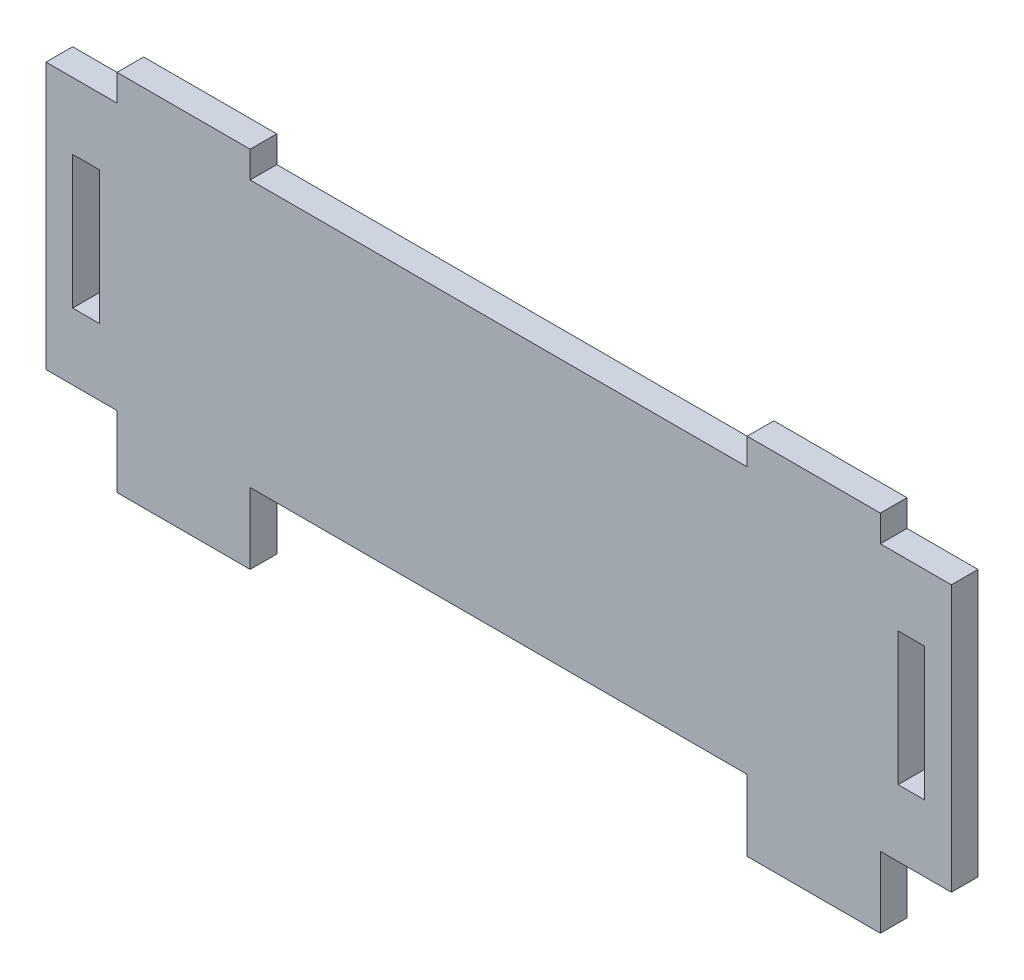
from build123d import *

# Parameters (mm, degrees)
SKETCH1_W           = 3
SKETCH1_H           = 15
BOSS_EXTRUDE1_DEPTH = 3


with BuildPart() as part:
    # Sketch1 → Boss-Extrude1 (new body)
    with BuildSketch(Plane.XY):
        Polygon((-51, 15), (-43, 15), (-43, 18), (-28, 18), (-28, 15), (28, 15), (28, 18), (43, 18), (43, 15), (51, 15), (51, -15), (43, -15), (43, -23), (28, -23), (28, -15), (-28, -15), (-28, -23), (-43, -23), (-43, -15), (-51, -15), align=None)
        with Locations((-46.5, 0)):
            Rectangle(SKETCH1_W, SKETCH1_H, mode=Mode.SUBTRACT)
        with Locations((46.5, 0)):
            Rectangle(SKETCH1_W, SKETCH1_H, mode=Mode.SUBTRACT)
    extrude(amount=BOSS_EXTRUDE1_DEPTH)


solid = part.part
